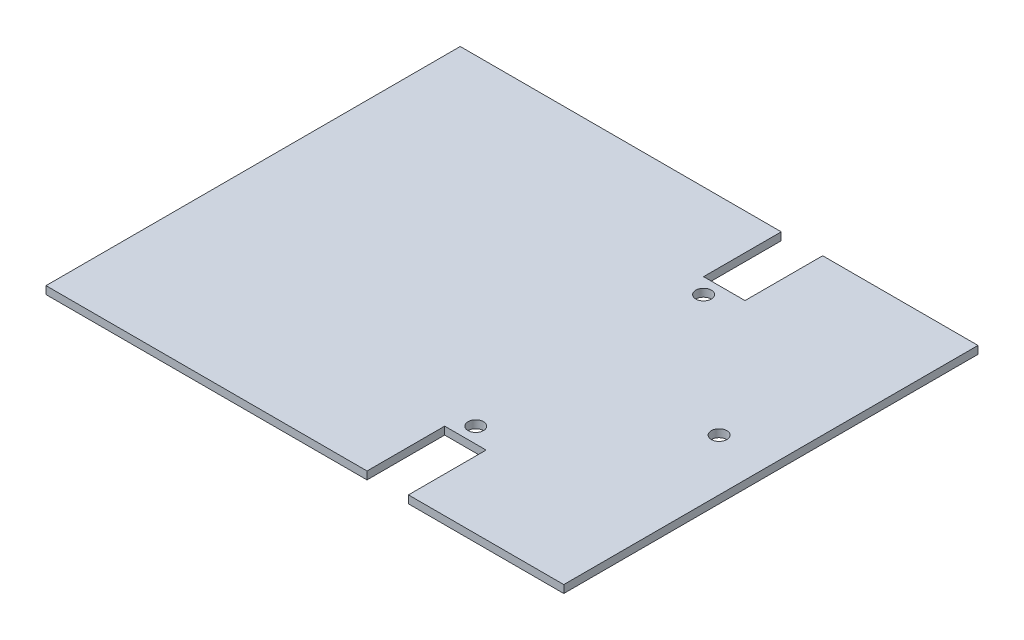
from build123d import *

# Parameters (mm, degrees)
SKETCH1_W           = 100
SKETCH1_H           = 80
BOSS_EXTRUDE1_DEPTH = 1.5
CUT_EXTRUDE1_REACH  = 130.071
SKETCH2_W           = 8
SKETCH2_H           = 15
CUT_EXTRUDE2_REACH  = 130.071
SKETCH3_R           = 1.5


with BuildPart() as part:
    # Sketch1 → Boss-Extrude1 (new body)
    with BuildSketch(Plane(origin=(0, 0, 0), x_dir=(1, 0, 0), z_dir=(0, 1, 0))):
        with Locations((50, 40)):
            Rectangle(SKETCH1_W, SKETCH1_H)
    extrude(amount=BOSS_EXTRUDE1_DEPTH)

    # Sketch2 → Cut-Extrude1 (cut, up to next)
    with BuildSketch(Plane(origin=(0, 1.5, 0), x_dir=(1, 0, 0), z_dir=(0, 1, 0)), mode=Mode.PRIVATE) as cut_extrude1_sk1:
        with Locations((66, 72.5)):
            Rectangle(SKETCH2_W, SKETCH2_H)
    cut_extrude1_tool1 = extrude(cut_extrude1_sk1.sketch, amount=-CUT_EXTRUDE1_REACH, mode=Mode.PRIVATE) & part.part
    # Sketch2 → Cut-Extrude1 (cut, up to next)
    with BuildSketch(Plane(origin=(0, 1.5, 0), x_dir=(1, 0, 0), z_dir=(0, 1, 0)), mode=Mode.PRIVATE) as cut_extrude1_sk2:
        with Locations((66, 7.5)):
            Rectangle(SKETCH2_W, SKETCH2_H)
    cut_extrude1_tool2 = extrude(cut_extrude1_sk2.sketch, amount=-CUT_EXTRUDE1_REACH, mode=Mode.PRIVATE) & part.part
    add(cut_extrude1_tool1.solids().sort_by_distance((66, 1.5, -72.5))[0], mode=Mode.SUBTRACT)
    add(cut_extrude1_tool2.solids().sort_by_distance((66, 1.5, -7.5))[0], mode=Mode.SUBTRACT)

    # Sketch3 → Cut-Extrude2 (cut, up to next)
    with BuildSketch(Plane(origin=(0, 1.5, 0), x_dir=(1, 0, 0), z_dir=(0, 1, 0)), mode=Mode.PRIVATE) as cut_extrude2_sk1:
        with Locations(Location((65, 62, 0), (0, 0, 270))):
            Circle(SKETCH3_R)
    cut_extrude2_tool1 = extrude(cut_extrude2_sk1.sketch, amount=-CUT_EXTRUDE2_REACH, mode=Mode.PRIVATE) & part.part
    # Sketch3 → Cut-Extrude2 (cut, up to next)
    with BuildSketch(Plane(origin=(0, 1.5, 0), x_dir=(1, 0, 0), z_dir=(0, 1, 0)), mode=Mode.PRIVATE) as cut_extrude2_sk2:
        with Locations(Location((90, 40, 0), (0, 0, 270))):
            Circle(SKETCH3_R)
    cut_extrude2_tool2 = extrude(cut_extrude2_sk2.sketch, amount=-CUT_EXTRUDE2_REACH, mode=Mode.PRIVATE) & part.part
    # Sketch3 → Cut-Extrude2 (cut, up to next)
    with BuildSketch(Plane(origin=(0, 1.5, 0), x_dir=(1, 0, 0), z_dir=(0, 1, 0)), mode=Mode.PRIVATE) as cut_extrude2_sk3:
        with Locations(Location((65, 18, 0), (0, 0, 270))):
            Circle(SKETCH3_R)
    cut_extrude2_tool3 = extrude(cut_extrude2_sk3.sketch, amount=-CUT_EXTRUDE2_REACH, mode=Mode.PRIVATE) & part.part
    add(cut_extrude2_tool1.solids().sort_by_distance((65, 1.5, -62))[0], mode=Mode.SUBTRACT)
    add(cut_extrude2_tool2.solids().sort_by_distance((90, 1.5, -40))[0], mode=Mode.SUBTRACT)
    add(cut_extrude2_tool3.solids().sort_by_distance((65, 1.5, -18))[0], mode=Mode.SUBTRACT)


solid = part.part
